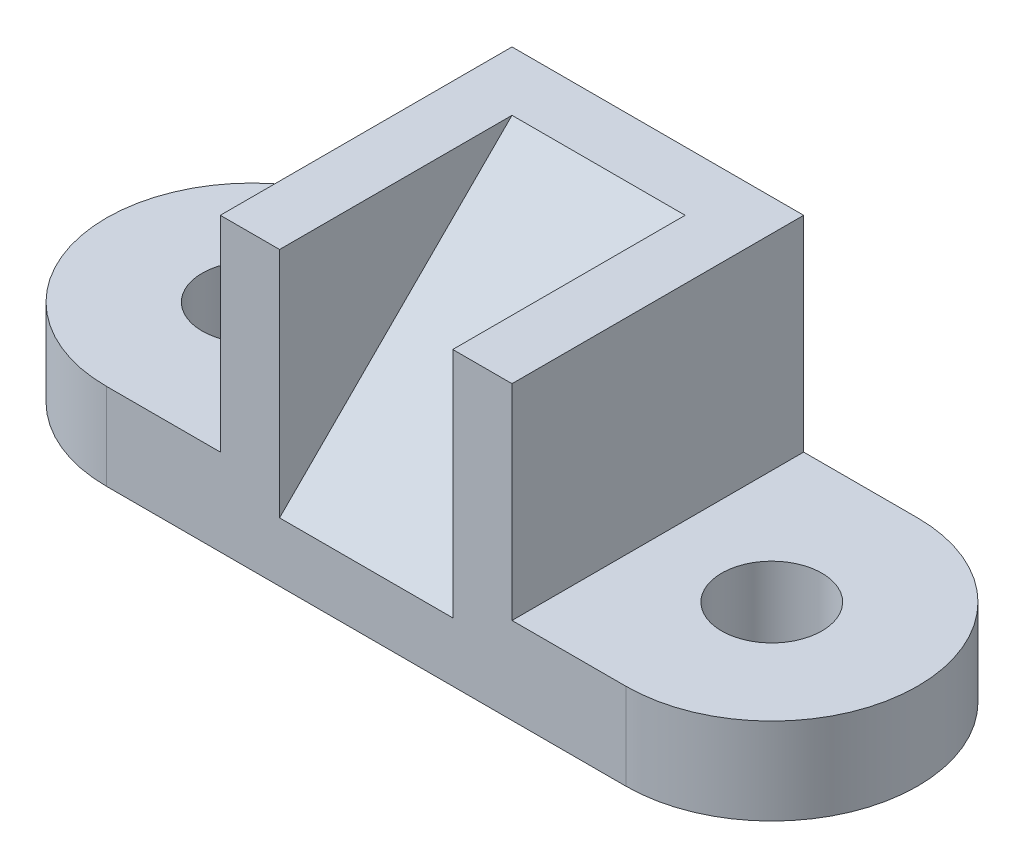
from build123d import *

# Parameters (mm, degrees)
SKETCH1_R           = 11
BOSS_EXTRUDE1_DEPTH = 19
SKETCH2_W           = 64
SKETCH2_H           = 64
BOSS_EXTRUDE2_DEPTH = 45
CUT_EXTRUDE1_START  = -13
CUT_EXTRUDE1_DEPTH  = 38


with BuildPart() as part:
    # Sketch1 → Boss-Extrude1 (new body)
    with BuildSketch(Plane(origin=(0, 0, 0), x_dir=(1, 0, 0), z_dir=(0, 1, 0))):
        with BuildLine():
            Line((57, -32), (-57, -32))
            ThreePointArc((-57, -32), (-89, 0), (-57, 32))
            Line((-57, 32), (57, 32))
            ThreePointArc((57, 32), (89, 0), (57, -32))
        make_face()
        with Locations(Location((-57, 0, 0), (0, 0, 270))):
            Circle(SKETCH1_R, mode=Mode.SUBTRACT)
        with Locations(Location((57, 0, 0), (0, 0, 270))):
            Circle(SKETCH1_R, mode=Mode.SUBTRACT)
    extrude(amount=BOSS_EXTRUDE1_DEPTH)

    # Sketch2 → Boss-Extrude2 (add)
    with BuildSketch(Plane(origin=(0, 19, 0), x_dir=(1, 0, 0), z_dir=(0, 1, 0))):
        Rectangle(SKETCH2_W, SKETCH2_H)
    extrude(amount=BOSS_EXTRUDE2_DEPTH)

    # Sketch5 → Cut-Extrude1 (cut)
    with BuildSketch(Plane.ZY.offset(32).offset(CUT_EXTRUDE1_START)):
        Polygon((-19, 64), (32, 13), (32, 64), align=None)
    extrude(amount=-CUT_EXTRUDE1_DEPTH, mode=Mode.SUBTRACT)


solid = part.part
